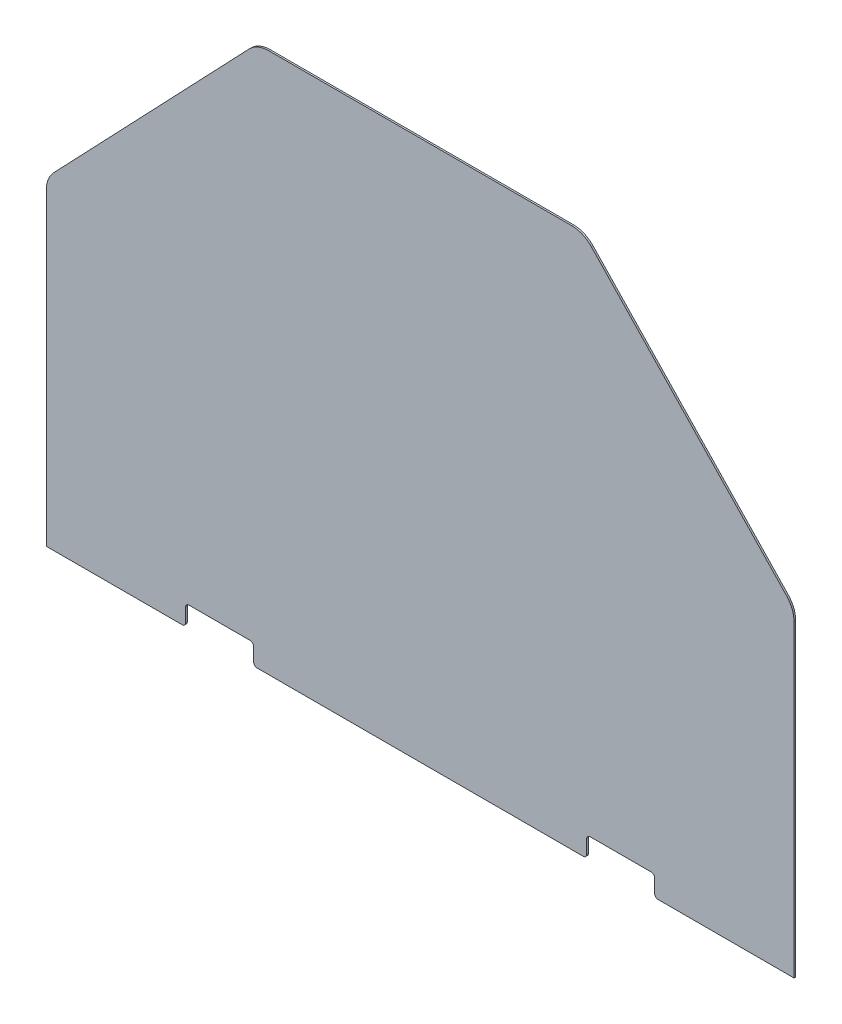
from build123d import *

# Parameters (mm, degrees)
BOSS_EXTRUDE1_DEPTH = 3.175
FILLET2_R           = 50.8
SKETCH2_W           = 127
SKETCH2_H           = 38.1
CUT_EXTRUDE1_DEPTH  = 1228.723687613
FILLET3_R           = 6.35


with BuildPart() as part:
    # Sketch1 → Boss-Extrude1 (new body)
    with BuildSketch(Plane.XY):
        Polygon((-304.8, 1009.65), (304.8, 1009.65), (698.5, 596.9), (698.5, 0), (-698.5, 0), (-698.5, 596.9), align=None)
    extrude(amount=BOSS_EXTRUDE1_DEPTH)

    # Fillet2
    fillet2_edges = [part.edges().sort_by_distance(p)[0] for p in [
        (698.5, 596.9, 1.5875),
        (-698.5, 596.9, 1.5875),
        (-304.8, 1009.65, 1.5875),
        (304.8, 1009.65, 1.5875),
    ]]
    fillet(fillet2_edges, radius=FILLET2_R)

    # Sketch2 → Cut-Extrude1 (cut, through all)
    with BuildSketch(Plane(origin=(0, 0, 0), x_dir=(-1, 0, 0), z_dir=(0, 0, -1))):
        with Locations((374.65, 19.05)):
            Rectangle(SKETCH2_W, SKETCH2_H)
        with Locations((-374.65, 19.05)):
            Rectangle(SKETCH2_W, SKETCH2_H)
    extrude(amount=-CUT_EXTRUDE1_DEPTH, mode=Mode.SUBTRACT)

    # Fillet3
    fillet3_edges = [part.edges().sort_by_distance(p)[0] for p in [
        (-311.15, 0, 1.5875),
        (-311.15, 38.1, 1.5875),
        (-438.15, 38.1, 1.5875),
        (-438.15, 0, 1.5875),
        (311.15, 0, 1.5875),
        (438.15, 0, 1.5875),
        (438.15, 38.1, 1.5875),
        (311.15, 38.1, 1.5875),
    ]]
    fillet(fillet3_edges, radius=FILLET3_R)


solid = part.part
